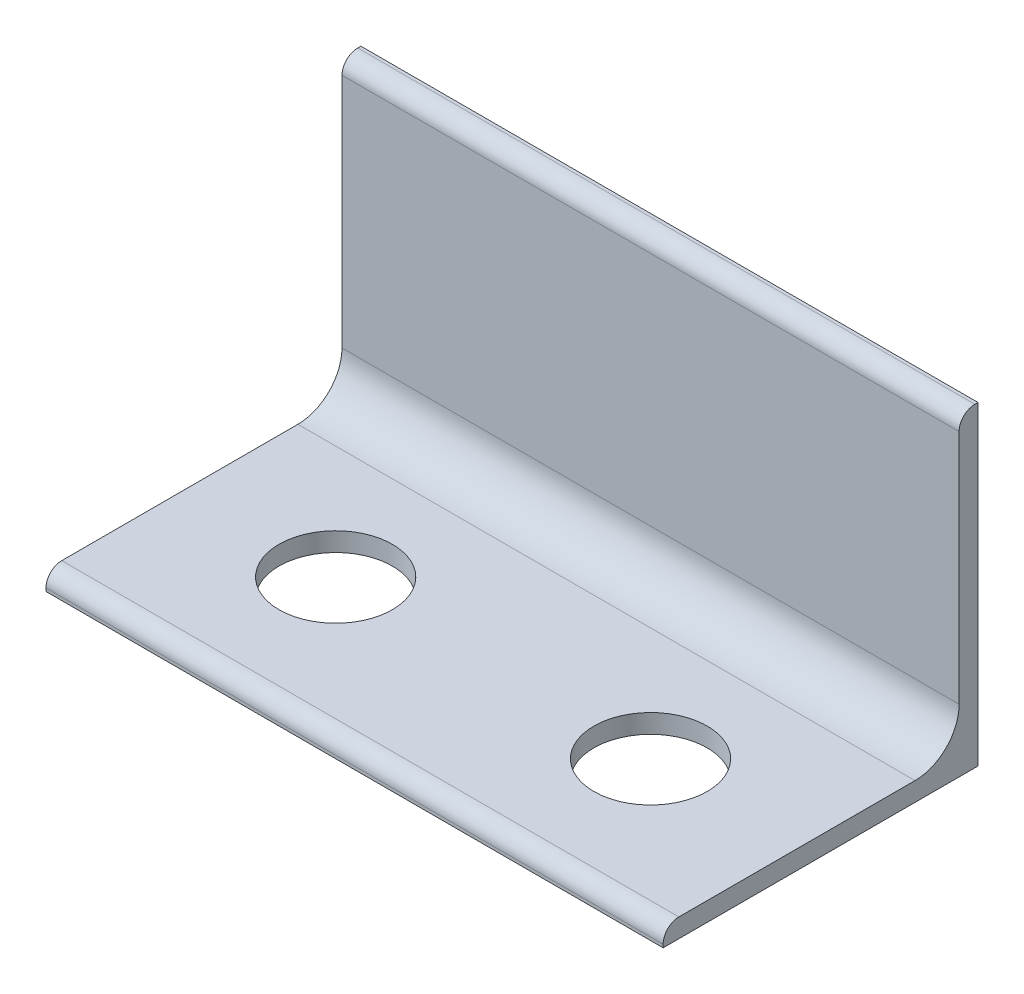
from build123d import *

# Parameters (mm, degrees)
ANGLES_EQUAL_50_X_50_X_3_1_DEPTH = 98
F_18_0_18_DIAMETER_HOLE1_D       = 18
LPATTERN1_COUNT                  = 2
LPATTERN1_PITCH                  = 50


with BuildPart() as part:
    # Sketch14 → Angles equal 50 X 50 X 3(1) (new body)
    with BuildSketch(Plane(origin=(0, 25, 25), x_dir=(0, 1, 0), z_dir=(1, 0, 0))):
        with BuildLine():
            Line((-25, 25), (-25, -25))
            Line((-25, -25), (25, -25))
            Line((25, -25), (25, -24.5))
            ThreePointArc((25, -24.5), (24.267766953, -22.732233047), (22.5, -22))
            Line((22.5, -22), (-15, -22))
            ThreePointArc((-15, -22), (-19.949747468, -19.949747468), (-22, -15))
            Line((-22, -15), (-22, 22.5))
            ThreePointArc((-22, 22.5), (-22.732233047, 24.267766953), (-24.5, 25))
            Line((-24.5, 25), (-25, 25))
        make_face()
    extrude(amount=ANGLES_EQUAL_50_X_50_X_3_1_DEPTH)

    # Ø18.0 (18) Diameter Hole1 (through all)
    with Locations(Plane(origin=(0, 3, 0), x_dir=(1, 0, 0), z_dir=(0, 1, 0))):
        with Locations((24, -28)):
            f_18_0_18_diameter_hole1 = Hole(F_18_0_18_DIAMETER_HOLE1_D / 2)

    # LPattern1: Ø18.0 (18) Diameter Hole1 ×2
    with Locations(*[(i * LPATTERN1_PITCH, 0, 0) for i in range(1, LPATTERN1_COUNT)]):
        add(f_18_0_18_diameter_hole1, mode=Mode.SUBTRACT)


solid = part.part
